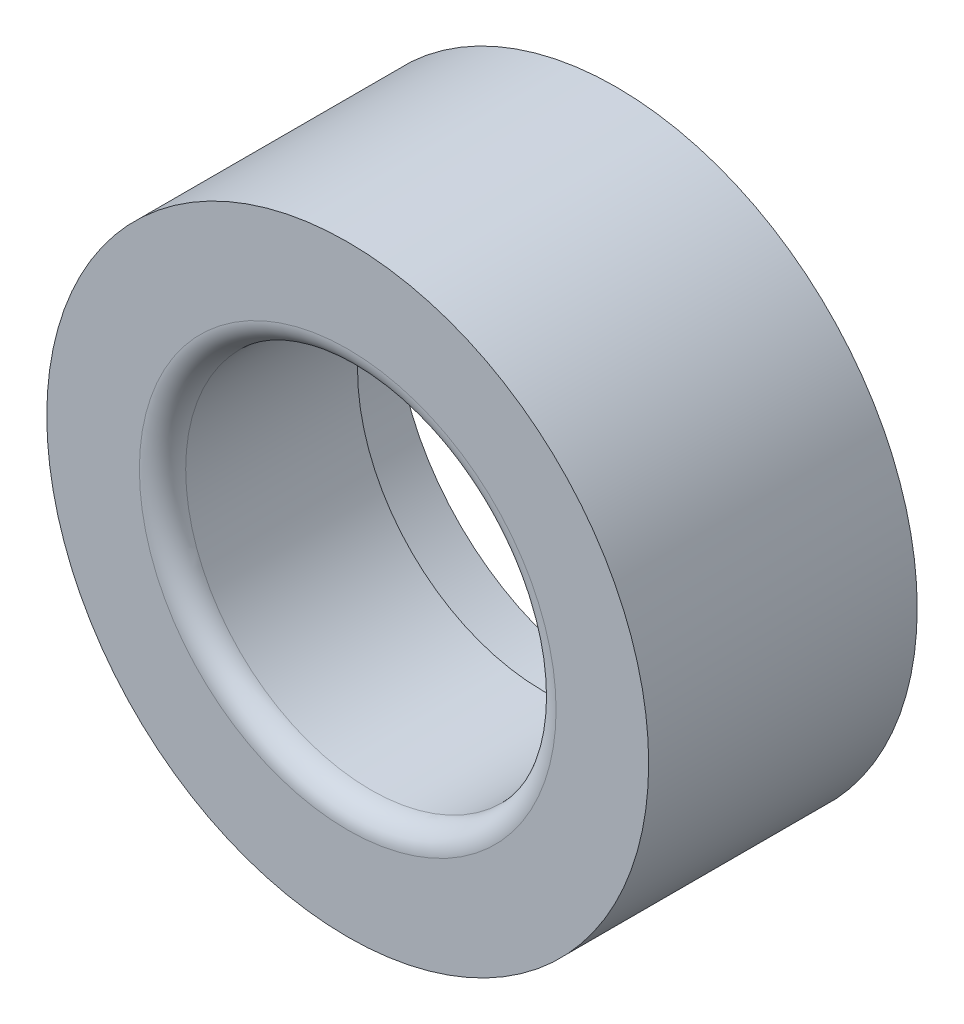
from build123d import *

# Parameters (mm, degrees)
SKETCH1_R           = 6.5
BOSS_EXTRUDE1_DEPTH = 5.8
SKETCH2_R           = 4
CUT_EXTRUDE1_DEPTH  = 93.260613645
FILLET1_R           = 0.5
SKETCH3_R           = 4.775
CUT_EXTRUDE2_DEPTH  = 1.5875


with BuildPart() as part:
    # Sketch1 → Boss-Extrude1 (new body)
    with BuildSketch(Plane.XY):
        with Locations((85.206527413, -1.763997815)):
            Circle(SKETCH1_R)
    extrude(amount=BOSS_EXTRUDE1_DEPTH)

    # Sketch2 → Cut-Extrude1 (cut, through all)
    with BuildSketch(Plane.XY.offset(5.8)):
        with Locations((85.206527413, -1.763997815)):
            Circle(SKETCH2_R)
    extrude(amount=-CUT_EXTRUDE1_DEPTH, mode=Mode.SUBTRACT)

    # Fillet1
    fillet1_edges = [part.edges().sort_by_distance(p)[0] for p in [
        (81.206527413, -1.763997815, 5.8),
    ]]
    fillet(fillet1_edges, radius=FILLET1_R)

    # Sketch3 → Cut-Extrude2 (cut)
    with BuildSketch(Plane(origin=(0, 0, 0), x_dir=(-1, 0, 0), z_dir=(0, 0, -1))):
        with Locations((-85.206527413, -1.763997815)):
            Circle(SKETCH3_R)
    extrude(amount=-CUT_EXTRUDE2_DEPTH, mode=Mode.SUBTRACT)


solid = part.part
